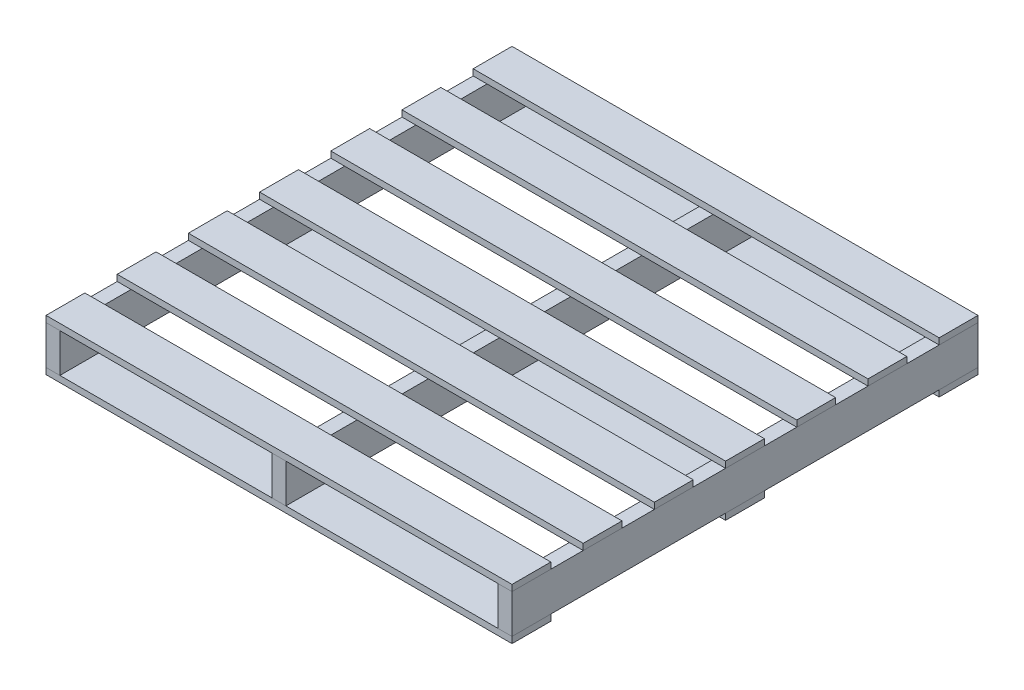
from build123d import *

# Parameters (mm, degrees)
BOSS_EXTRUDE1_DEPTH        = 533.4
BOSS_EXTRUDE1_DEPTH_BACK   = 533.4
SKETCH3_W                  = 31.75
SKETCH3_H                  = 88.9
BOSS_EXTRUDE1_2_DEPTH      = 533.4
BOSS_EXTRUDE1_2_DEPTH_BACK = 533.4
SKETCH3_W_2                = 31.496
BOSS_EXTRUDE1_3_DEPTH      = 533.4
BOSS_EXTRUDE1_3_DEPTH_BACK = 533.4
SKETCH4_W                  = 1066.8
SKETCH4_H                  = 88.9
BOSS_EXTRUDE2_DEPTH        = 14.3002
BOSS_EXTRUDE2_2_DEPTH      = 14.3002
BOSS_EXTRUDE2_3_DEPTH      = 14.3002
BOSS_EXTRUDE2_4_DEPTH      = 14.3002
BOSS_EXTRUDE2_5_DEPTH      = 14.3002
BOSS_EXTRUDE2_6_DEPTH      = 14.3002
BOSS_EXTRUDE2_7_DEPTH      = 14.3002
SKETCH5_W                  = 1066.8
SKETCH5_H                  = 88.9
BOSS_EXTRUDE3_DEPTH        = 14.3002
BOSS_EXTRUDE3_2_DEPTH      = 14.3002
BOSS_EXTRUDE3_3_DEPTH      = 14.3002


with BuildPart() as part:
    # Sketch3 → Boss-Extrude1 (new, two sides: drawn at the far end of the back side and taken through both)
    with BuildSketch(Plane.XY.offset(-BOSS_EXTRUDE1_DEPTH_BACK)):
        with Locations((-517.525, 0)):
            Rectangle(SKETCH3_W, SKETCH3_H)
    extrude(amount=BOSS_EXTRUDE1_DEPTH + BOSS_EXTRUDE1_DEPTH_BACK)


with BuildPart() as body_2:
    # Sketch3 → Boss-Extrude1 2 (new, two sides: drawn at the far end of the back side and taken through both)
    with BuildSketch(Plane.XY.offset(-BOSS_EXTRUDE1_2_DEPTH_BACK)):
        Rectangle(SKETCH3_W_2, SKETCH3_H)
    extrude(amount=BOSS_EXTRUDE1_2_DEPTH + BOSS_EXTRUDE1_2_DEPTH_BACK)


with BuildPart() as body_3:
    # Sketch3 → Boss-Extrude1 3 (new, two sides: drawn at the far end of the back side and taken through both)
    with BuildSketch(Plane.XY.offset(-BOSS_EXTRUDE1_3_DEPTH_BACK)):
        with Locations((517.525, 0)):
            Rectangle(SKETCH3_W, SKETCH3_H)
    extrude(amount=BOSS_EXTRUDE1_3_DEPTH + BOSS_EXTRUDE1_3_DEPTH_BACK)


with BuildPart() as body_4:
    # Sketch4 → Boss-Extrude2 (new body)
    with BuildSketch(Plane(origin=(0, 44.45, 0), x_dir=(1, 0, 0), z_dir=(0, 1, 0))):
        with Locations((0, -488.95)):
            Rectangle(SKETCH4_W, SKETCH4_H)
    extrude(amount=BOSS_EXTRUDE2_DEPTH)


with BuildPart() as body_5:
    # Sketch4 → Boss-Extrude2 2 (new body)
    with BuildSketch(Plane(origin=(0, 44.45, 0), x_dir=(1, 0, 0), z_dir=(0, 1, 0))):
        with Locations((0, -325.966666667)):
            Rectangle(SKETCH4_W, SKETCH4_H)
    extrude(amount=BOSS_EXTRUDE2_2_DEPTH)


with BuildPart() as body_6:
    # Sketch4 → Boss-Extrude2 3 (new body)
    with BuildSketch(Plane(origin=(0, 44.45, 0), x_dir=(1, 0, 0), z_dir=(0, 1, 0))):
        with Locations((0, -162.983333333)):
            Rectangle(SKETCH4_W, SKETCH4_H)
    extrude(amount=BOSS_EXTRUDE2_3_DEPTH)


with BuildPart() as body_7:
    # Sketch4 → Boss-Extrude2 4 (new body)
    with BuildSketch(Plane(origin=(0, 44.45, 0), x_dir=(1, 0, 0), z_dir=(0, 1, 0))):
        Rectangle(SKETCH4_W, SKETCH4_H)
    extrude(amount=BOSS_EXTRUDE2_4_DEPTH)


with BuildPart() as body_8:
    # Sketch4 → Boss-Extrude2 5 (new body)
    with BuildSketch(Plane(origin=(0, 44.45, 0), x_dir=(1, 0, 0), z_dir=(0, 1, 0))):
        with Locations((0, 162.983333333)):
            Rectangle(SKETCH4_W, SKETCH4_H)
    extrude(amount=BOSS_EXTRUDE2_5_DEPTH)


with BuildPart() as body_9:
    # Sketch4 → Boss-Extrude2 6 (new body)
    with BuildSketch(Plane(origin=(0, 44.45, 0), x_dir=(1, 0, 0), z_dir=(0, 1, 0))):
        with Locations((0, 325.966666667)):
            Rectangle(SKETCH4_W, SKETCH4_H)
    extrude(amount=BOSS_EXTRUDE2_6_DEPTH)


with BuildPart() as body_10:
    # Sketch4 → Boss-Extrude2 7 (new body)
    with BuildSketch(Plane(origin=(0, 44.45, 0), x_dir=(1, 0, 0), z_dir=(0, 1, 0))):
        with Locations((0, 488.95)):
            Rectangle(SKETCH4_W, SKETCH4_H)
    extrude(amount=BOSS_EXTRUDE2_7_DEPTH)


with BuildPart() as body_11:
    # Sketch5 → Boss-Extrude3 (new body)
    with BuildSketch(Plane.XZ.offset(44.45)):
        with Locations((0, 488.95)):
            Rectangle(SKETCH5_W, SKETCH5_H)
    extrude(amount=BOSS_EXTRUDE3_DEPTH)


with BuildPart() as body_12:
    # Sketch5 → Boss-Extrude3 2 (new body)
    with BuildSketch(Plane.XZ.offset(44.45)):
        with Locations((0, -488.95)):
            Rectangle(SKETCH5_W, SKETCH5_H)
    extrude(amount=BOSS_EXTRUDE3_2_DEPTH)


with BuildPart() as body_13:
    # Sketch5 → Boss-Extrude3 3 (new body)
    with BuildSketch(Plane.XZ.offset(44.45)):
        Rectangle(SKETCH5_W, SKETCH5_H)
    extrude(amount=BOSS_EXTRUDE3_3_DEPTH)


solid = Compound([part.part, body_2.part, body_3.part, body_4.part, body_5.part, body_6.part, body_7.part, body_8.part, body_9.part, body_10.part, body_11.part, body_12.part, body_13.part])
